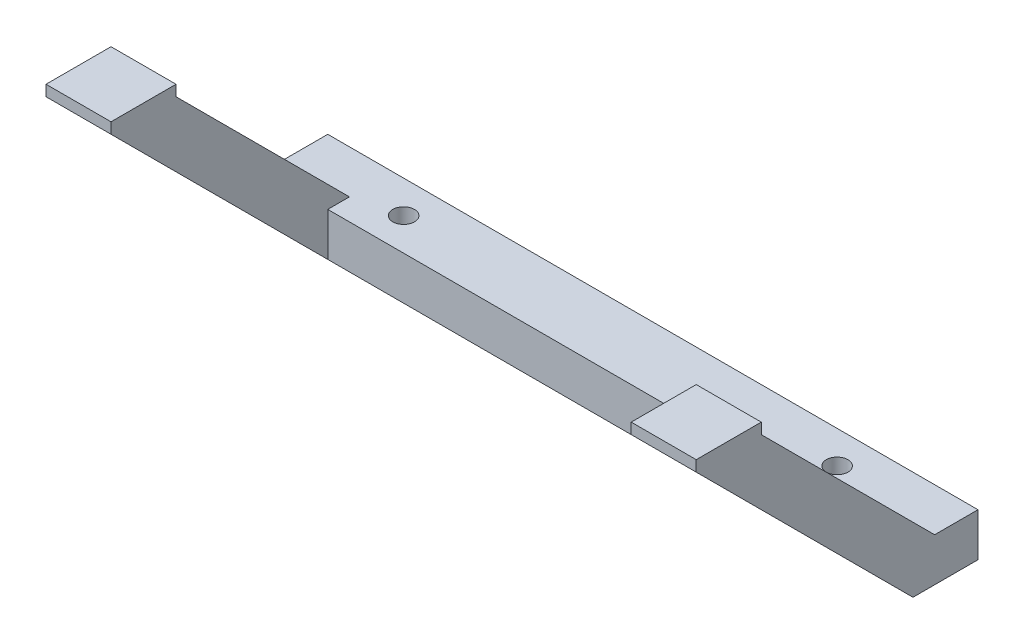
from build123d import *

# Parameters (mm, degrees)
SKETCH1_W           = 24
SKETCH1_H           = 3
BOSS_EXTRUDE1_DEPTH = 2
BOSS_EXTRUDE2_DEPTH = 3
BOSS_EXTRUDE3_DEPTH = 3
CUT_EXTRUDE1_REACH  = 23.383
SKETCH6_R           = 0.5
SKETCH9_W           = 3
SKETCH9_H           = 3
BOSS_EXTRUDE4_DEPTH = 0.5


with BuildPart() as part:
    # Sketch1 → Boss-Extrude1 (new body)
    with BuildSketch(Plane(origin=(0, 0, 0), x_dir=(1, 0, 0), z_dir=(0, 1, 0))):
        Rectangle(SKETCH1_W, SKETCH1_H)
    extrude(amount=BOSS_EXTRUDE1_DEPTH)

    # Sketch4 → Boss-Extrude2 (add)
    with BuildSketch(Plane(origin=(12, 0, 0), x_dir=(0, 0, -1), z_dir=(1, 0, 0))):
        Polygon((-11.5, 10), (-1.5, 0), (1.5, 0), (1.5, 2), (-0.5, 2), (-8.5, 10), align=None)
    extrude(amount=BOSS_EXTRUDE2_DEPTH)

    # Sketch5 → Boss-Extrude3 (add)
    with BuildSketch(Plane.ZY.offset(12)):
        Polygon((1.5, 0), (11.5, 10), (8.5, 10), (0.5, 2), (-1.5, 2), (-1.5, 0), align=None)
    extrude(amount=BOSS_EXTRUDE3_DEPTH)

    # Sketch6 → Cut-Extrude1 (cut, up to next)
    with BuildSketch(Plane.XZ, mode=Mode.PRIVATE) as cut_extrude1_sk1:
        with Locations(Location((-10, 0, 0), (0, 0, 270))):
            Circle(SKETCH6_R)
    cut_extrude1_tool1 = extrude(cut_extrude1_sk1.sketch, amount=-CUT_EXTRUDE1_REACH, mode=Mode.PRIVATE) & part.part
    # Sketch6 → Cut-Extrude1 (cut, up to next)
    with BuildSketch(Plane.XZ, mode=Mode.PRIVATE) as cut_extrude1_sk2:
        with Locations(Location((10, 0, 0), (0, 0, 270))):
            Circle(SKETCH6_R)
    cut_extrude1_tool2 = extrude(cut_extrude1_sk2.sketch, amount=-CUT_EXTRUDE1_REACH, mode=Mode.PRIVATE) & part.part
    add(cut_extrude1_tool1.solids().sort_by_distance((-10, 0, 0))[0], mode=Mode.SUBTRACT)
    add(cut_extrude1_tool2.solids().sort_by_distance((10, 0, 0))[0], mode=Mode.SUBTRACT)

    # Sketch9 → Boss-Extrude4 (add)
    with BuildSketch(Plane(origin=(0, 10, 0), x_dir=(1, 0, 0), z_dir=(0, 1, 0))):
        with Locations((-13.5, -10)):
            Rectangle(SKETCH9_W, SKETCH9_H)
        with Locations((13.5, -10)):
            Rectangle(SKETCH9_W, SKETCH9_H)
    extrude(amount=BOSS_EXTRUDE4_DEPTH)


solid = part.part
